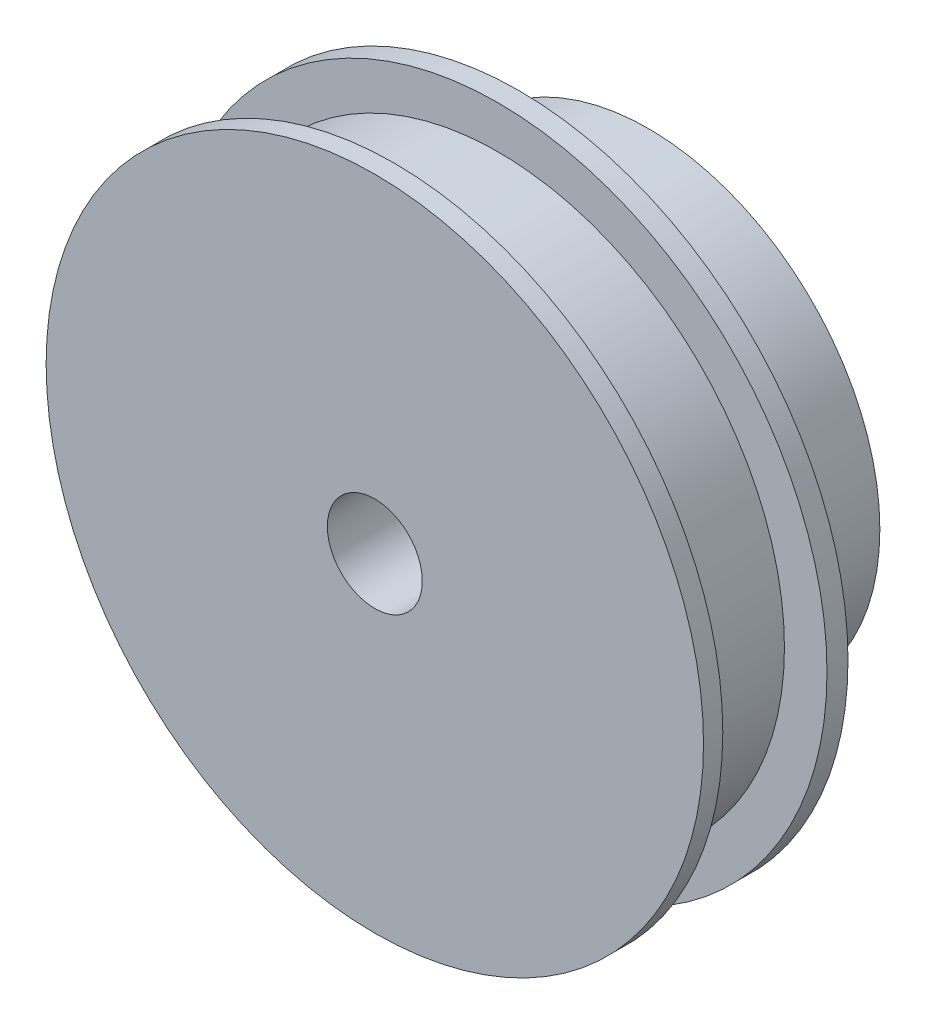
from build123d import *

# Parameters (mm, degrees)
SKETCH1_R           = 15.53845
BOSS_EXTRUDE1_DEPTH = 8.6741
SKETCH2_R           = 22.0726
BOSS_EXTRUDE2_DEPTH = 1.4097
SKETCH3_R           = 19.2151
BOSS_EXTRUDE3_DEPTH = 6.9977
BOSS_EXTRUDE5_START = 8.4074
SKETCH2_3_R         = 22.0726
BOSS_EXTRUDE5_DEPTH = 1.2954
SKETCH5_R           = 3.1877
CUT_EXTRUDE1_DEPTH  = 37.223056126


with BuildPart() as part:
    # Sketch1 → Boss-Extrude1 (new body)
    with BuildSketch(Plane.XY):
        Circle(SKETCH1_R)
    extrude(amount=-BOSS_EXTRUDE1_DEPTH)

    # Sketch2 → Boss-Extrude2 (add)
    with BuildSketch(Plane.XY):
        Circle(SKETCH2_R)
    extrude(amount=BOSS_EXTRUDE2_DEPTH)

    # Sketch3 → Boss-Extrude3 (add)
    with BuildSketch(Plane.XY.offset(1.4097)):
        Circle(SKETCH3_R)
    extrude(amount=BOSS_EXTRUDE3_DEPTH)

    # Sketch2<3> → Boss-Extrude5 (add)
    with BuildSketch(Plane.XY.offset(BOSS_EXTRUDE5_START)):
        Circle(SKETCH2_3_R)
    extrude(amount=BOSS_EXTRUDE5_DEPTH)

    # Sketch5 → Cut-Extrude1 (cut, through all)
    with BuildSketch(Plane(origin=(0, 0, -8.6741), x_dir=(-1, 0, 0), z_dir=(0, 0, -1))):
        Circle(SKETCH5_R)
    extrude(amount=-CUT_EXTRUDE1_DEPTH, mode=Mode.SUBTRACT)


solid = part.part
